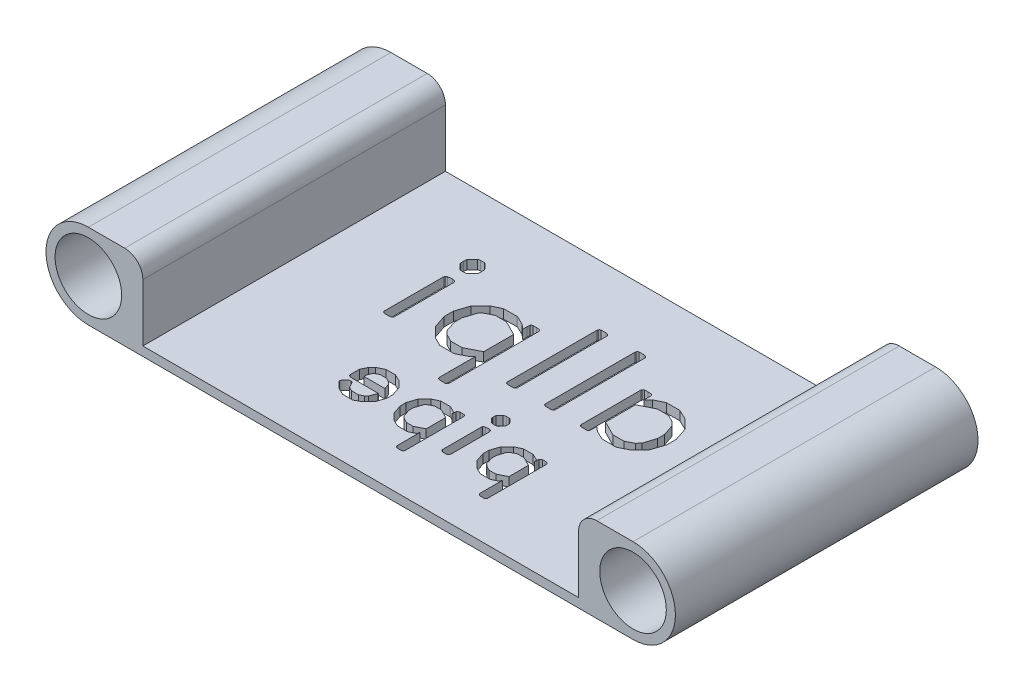
from build123d import *

# Parameters (mm, degrees)
SKETCH1_R           = 11
BOSS_EXTRUDE1_DEPTH = 100
CUT_EXTRUDE1_DEPTH  = 10
CUT_EXTRUDE2_DEPTH  = 10


with BuildPart() as part:
    # Sketch1 → Boss-Extrude1 (new body)
    with BuildSketch(Plane.XY):
        with BuildLine():
            Line((180, -14), (0, -14))
            ThreePointArc((0, -14), (-14, 0), (0, 14))
            Line((0, 14), (12, 14))
            ThreePointArc((12, 14), (16.242640687, 12.242640687), (18, 8))
            Line((18, 8), (18, -5))
            Line((18, -5), (18, -11))
            Line((18, -11), (24, -11))
            Line((24, -11), (25, -11))
            Line((25, -11), (155, -11))
            Line((155, -11), (156, -11))
            Line((156, -11), (162, -11))
            Line((162, -11), (162, -5))
            Line((162, -5), (162, 8))
            ThreePointArc((162, 8), (163.757359313, 12.242640687), (168, 14))
            Line((168, 14), (180, 14))
            ThreePointArc((180, 14), (194, 0), (180, -14))
        make_face()
        Circle(SKETCH1_R, mode=Mode.SUBTRACT)
        with Locations((180, 0)):
            Circle(SKETCH1_R, mode=Mode.SUBTRACT)
    extrude(amount=BOSS_EXTRUDE1_DEPTH)

    # Sketch3 → Cut-Extrude1 (cut)
    # profile 1 of 6: a face of its own
    with BuildSketch(Plane(origin=(0, -14, 0), x_dir=(-1, 0, 0), z_dir=(0, -1, 0))):
        with BuildLine():
            add(Edge.make_bspline(
                [(-120.723772714, -29.719538981), (-120.527466544, -29.811853521), (-120.090458077, -30.017360234), (-119.368965663, -30.358240333), (-118.515838935, -30.760979126), (-117.90451555, -31.052841221), (-117.577501363, -31.208966519)],
                knots=[0, 0, 0, 0, 0.747812145, 1.664747666, 2.750807408, 4, 4, 4, 4], degree=3))
            Line((-117.577501363, -31.208966519), (-116.232398198, -32.530977784))
            Line((-116.232398198, -32.530977784), (-116.232398198, -30.308382426))
            add(Edge.make_bspline(
                [(-116.232398198, -30.308382426), (-116.215250099, -30.237531157), (-116.182938448, -30.104028228), (-116.076216356, -29.938214819), (-115.934486963, -29.816322531), (-115.748659377, -29.759137796), (-115.533669716, -29.719344407), (-115.278049659, -29.701134513), (-114.983828981, -29.681179143), (-114.773816325, -29.679840131), (-114.66214901, -29.679128156)],
                knots=[0, 0, 0, 0, 0.93046279, 1.753243242, 2.490653353, 3.280471223, 4.211262276, 5.303341114, 6.566140431, 8, 8, 8, 8], degree=3))
            Line((-114.66214901, -29.679128156), (-113.536418894, -29.679128156))
            add(Edge.make_bspline(
                [(-113.536418894, -29.679128156), (-113.473726445, -29.695509466), (-113.354904069, -29.726557322), (-113.198163817, -29.817373675), (-113.071549006, -29.938419901), (-113.023492153, -30.042760682), (-112.999532223, -30.094782353)],
                knots=[0, 0, 0, 0, 1.092314502, 2.07028767, 3.037894303, 4, 4, 4, 4], degree=3))
            Line((-112.999532223, -30.094782353), (-112.907164624, -30.516209525))
            Line((-112.907164624, -30.516209525), (-112.907164624, -50.109686524))
            add(Edge.make_bspline(
                [(-112.907164624, -50.109686524), (-112.935369151, -50.17472428), (-112.988339176, -50.29686962), (-113.10247661, -50.447361565), (-113.221970999, -50.573638831), (-113.378293033, -50.640164403), (-113.554764664, -50.689224509), (-113.769056365, -50.711235281), (-114.022595276, -50.738851153), (-114.20596361, -50.738909518), (-114.304224563, -50.738940794)],
                knots=[0, 0, 0, 0, 1.017957162, 1.911792947, 2.716738227, 3.486456027, 4.321467898, 5.357801898, 6.584134479, 8, 8, 8, 8], degree=3))
            Line((-114.304224563, -50.738940794), (-115.441500629, -50.738940794))
            add(Edge.make_bspline(
                [(-115.441500629, -50.738940794), (-115.518529876, -50.711971213), (-115.660985963, -50.662094299), (-115.831075709, -50.538053563), (-115.956869742, -50.39349905), (-115.982795597, -50.277258725), (-115.995706225, -50.219373048)],
                knots=[0, 0, 0, 0, 1.213651149, 2.244498052, 3.125790306, 4, 4, 4, 4], degree=3))
            add(Edge.make_bspline(
                [(-115.995706225, -50.219373048), (-116.008511635, -50.104009167), (-116.039175862, -49.827755286), (-116.05484428, -49.343845448), (-116.075044229, -48.726270528), (-116.076002388, -48.270066849), (-116.076527875, -48.01986959)],
                knots=[0, 0, 0, 0, 0.632332228, 1.5142021, 2.63670582, 4, 4, 4, 4], degree=3))
            Line((-116.076527875, -48.01986959), (-117.554409463, -49.341880855))
            Line((-117.554409463, -49.341880855), (-120.515945615, -50.738940794))
            Line((-120.515945615, -50.738940794), (-125.249785079, -50.738940794))
            Line((-125.249785079, -50.738940794), (-128.251732056, -49.197556481))
            Line((-128.251732056, -49.197556481), (-131.380684482, -46.10901488))
            Line((-131.380684482, -46.10901488), (-132.858566071, -41.686916064))
            Line((-132.858566071, -41.686916064), (-132.858566071, -38.563736613))
            Line((-132.858566071, -38.563736613), (-131.432641257, -34.309054071))
            add(Edge.make_bspline(
                [(-131.432641257, -34.309054071), (-131.220075522, -34.080997755), (-130.768129863, -33.596116868), (-130.028543328, -32.847742266), (-129.189485657, -32.033595817), (-128.59318173, -31.473635162), (-128.280596931, -31.180101645)],
                knots=[0, 0, 0, 0, 0.84209508, 1.790416582, 2.84172792, 4, 4, 4, 4], degree=3))
            add(Edge.make_bspline(
                [(-128.280596931, -31.180101645), (-128.090228764, -31.085526782), (-127.662460357, -30.873011532), (-126.947456655, -30.526678683), (-126.08687115, -30.125554879), (-125.467174163, -29.83512332), (-125.13432558, -29.679128156)],
                knots=[0, 0, 0, 0, 0.731706252, 1.644186751, 2.734657232, 4, 4, 4, 4], degree=3))
            Line((-125.13432558, -29.679128156), (-120.723772714, -29.719538981))
        make_face()
        Polygon((-116.232398198, -35.417465262), (-121.041286336, -33.004361731), (-124.770628158, -33.004361731), (-127.09136409, -34.170502672), (-128.245959081, -35.290459813), (-129.533332496, -39.077531384), (-129.533332496, -41.404040291), (-128.292142881, -45.312344336), (-127.218369539, -46.478485277), (-124.741763283, -47.725447867), (-121.064378236, -47.725447867), (-116.232398198, -45.312344336), align=None, mode=Mode.SUBTRACT)
    # profile 2 of 6: a face of its own
    with BuildSketch(Plane(origin=(0, -14, 0), x_dir=(-1, 0, 0), z_dir=(0, -1, 0))):
        with BuildLine():
            add(Edge.make_bspline(
                [(-101.70759321, -19.703427433), (-101.650796729, -19.722289202), (-101.539647458, -19.759201206), (-101.386372979, -19.856614405), (-101.261009731, -19.995257808), (-101.201126696, -20.107995488), (-101.170706539, -20.165265429)],
                knots=[0, 0, 0, 0, 0.977880004, 1.913686345, 2.940167456, 4, 4, 4, 4], degree=3))
            Line((-101.170706539, -20.165265429), (-101.084111915, -20.586692601))
            Line((-101.084111915, -20.586692601), (-101.084111915, -50.103913549))
            add(Edge.make_bspline(
                [(-101.084111915, -50.103913549), (-101.095783589, -50.161234372), (-101.119507635, -50.277745663), (-101.230589247, -50.433121665), (-101.382193577, -50.579326852), (-101.511249212, -50.656868611), (-101.580587761, -50.69852997)],
                knots=[0, 0, 0, 0, 0.865095261, 1.758407532, 2.795645228, 4, 4, 4, 4], degree=3))
            add(Edge.make_bspline(
                [(-101.580587761, -50.69852997), (-101.647897586, -50.704949868), (-101.79960339, -50.719419314), (-102.053992755, -50.727118674), (-102.359785052, -50.742750402), (-102.581208128, -50.740274949), (-102.700544902, -50.738940794)],
                knots=[0, 0, 0, 0, 0.723506857, 1.630671128, 2.723041564, 4, 4, 4, 4], degree=3))
            Line((-102.700544902, -50.738940794), (-103.826275019, -50.738940794))
            add(Edge.make_bspline(
                [(-103.826275019, -50.738940794), (-103.941415368, -50.67962217), (-104.187321995, -50.552934671), (-104.332267511, -50.316328649), (-104.409345489, -50.190508174)],
                knots=[0, 0, 0, 0, 0.936455845, 2, 2, 2, 2], degree=3))
            Line((-104.409345489, -50.190508174), (-104.409345489, -49.474659279))
            Line((-104.409345489, -49.474659279), (-104.409345489, -20.378865503))
            add(Edge.make_bspline(
                [(-104.409345489, -20.378865503), (-104.366624569, -20.275928649), (-104.282688935, -20.073684172), (-104.025278488, -19.849719362), (-103.687647538, -19.718900721), (-103.43700317, -19.708871862), (-103.300934298, -19.703427433)],
                knots=[0, 0, 0, 0, 0.945973713, 1.858595364, 2.837482298, 4, 4, 4, 4], degree=3))
            add(Edge.make_bspline(
                [(-103.300934298, -19.703427433), (-103.212415348, -19.703427433), (-102.975723375, -19.703427433), (-102.739031402, -19.703427433), (-102.590858378, -19.703427433)],
                knots=[0, 0, 0, 0, 0.74796748, 2, 2, 2, 2], degree=3))
            add(Edge.make_bspline(
                [(-102.590858378, -19.703427433), (-102.436912379, -19.703427433), (-102.142490657, -19.703427433), (-101.848068934, -19.703427433), (-101.70759321, -19.703427433)],
                knots=[0, 0, 0, 0, 1.045751634, 2, 2, 2, 2], degree=3))
        make_face()
    # profile 3 of 6: a face of its own
    with BuildSketch(Plane(origin=(0, -14, 0), x_dir=(-1, 0, 0), z_dir=(0, -1, 0))):
        with BuildLine():
            add(Edge.make_bspline(
                [(-89.145599707, -19.703427433), (-89.088803226, -19.722289202), (-88.977653955, -19.759201206), (-88.824379475, -19.856614405), (-88.699016227, -19.995257808), (-88.639133193, -20.107995488), (-88.608713036, -20.165265429)],
                knots=[0, 0, 0, 0, 0.977880004, 1.913686345, 2.940167456, 4, 4, 4, 4], degree=3))
            Line((-88.608713036, -20.165265429), (-88.522118411, -20.586692601))
            Line((-88.522118411, -20.586692601), (-88.522118411, -50.103913549))
            add(Edge.make_bspline(
                [(-88.522118411, -50.103913549), (-88.533790086, -50.161234372), (-88.557514131, -50.277745663), (-88.668595743, -50.433121665), (-88.820200074, -50.579326852), (-88.949255708, -50.656868611), (-89.018594258, -50.69852997)],
                knots=[0, 0, 0, 0, 0.865095261, 1.758407532, 2.795645228, 4, 4, 4, 4], degree=3))
            add(Edge.make_bspline(
                [(-89.018594258, -50.69852997), (-89.085904083, -50.704949868), (-89.237609886, -50.719419314), (-89.491999252, -50.727118674), (-89.797791548, -50.742750402), (-90.019214625, -50.740274949), (-90.138551399, -50.738940794)],
                knots=[0, 0, 0, 0, 0.723506857, 1.630671128, 2.723041564, 4, 4, 4, 4], degree=3))
            Line((-90.138551399, -50.738940794), (-91.264281515, -50.738940794))
            add(Edge.make_bspline(
                [(-91.264281515, -50.738940794), (-91.379421865, -50.67962217), (-91.625328492, -50.552934671), (-91.770274008, -50.316328649), (-91.847351986, -50.190508174)],
                knots=[0, 0, 0, 0, 0.936455845, 2, 2, 2, 2], degree=3))
            Line((-91.847351986, -50.190508174), (-91.847351986, -49.474659279))
            Line((-91.847351986, -49.474659279), (-91.847351986, -20.378865503))
            add(Edge.make_bspline(
                [(-91.847351986, -20.378865503), (-91.804631066, -20.275928649), (-91.720695431, -20.073684172), (-91.463284984, -19.849719362), (-91.125654035, -19.718900721), (-90.875009667, -19.708871862), (-90.738940794, -19.703427433)],
                knots=[0, 0, 0, 0, 0.945973713, 1.858595364, 2.837482298, 4, 4, 4, 4], degree=3))
            add(Edge.make_bspline(
                [(-90.738940794, -19.703427433), (-90.650421845, -19.703427433), (-90.413729872, -19.703427433), (-90.177037899, -19.703427433), (-90.028864875, -19.703427433)],
                knots=[0, 0, 0, 0, 0.74796748, 2, 2, 2, 2], degree=3))
            add(Edge.make_bspline(
                [(-90.028864875, -19.703427433), (-89.874918876, -19.703427433), (-89.580497153, -19.703427433), (-89.28607543, -19.703427433), (-89.145599707, -19.703427433)],
                knots=[0, 0, 0, 0, 1.045751634, 2, 2, 2, 2], degree=3))
        make_face()
    # profile 4 of 6: a face of its own
    with BuildSketch(Plane(origin=(0, -14, 0), x_dir=(-1, 0, 0), z_dir=(0, -1, 0))):
        with BuildLine():
            add(Edge.make_bspline(
                [(-66.954283977, -29.719538981), (-66.898659611, -29.746868563), (-66.76726857, -29.811424127), (-66.533240253, -29.912478154), (-66.242145237, -30.052171347), (-65.887333033, -30.222085374), (-65.466562897, -30.413545761), (-64.988503233, -30.651073192), (-64.438930234, -30.898352065), (-64.055812355, -31.082954528), (-63.854196426, -31.180101645)],
                knots=[0, 0, 0, 0, 0.433973473, 1.025094407, 1.784689959, 2.69492059, 3.780168095, 5.021826328, 6.432734973, 8, 8, 8, 8], degree=3))
            Line((-63.854196426, -31.180101645), (-60.800292674, -34.268643246))
            Line((-60.800292674, -34.268643246), (-59.333957036, -38.731152887))
            Line((-59.333957036, -38.731152887), (-59.333957036, -41.733099864))
            Line((-59.333957036, -41.733099864), (-60.800292674, -46.149425705))
            add(Edge.make_bspline(
                [(-60.800292674, -46.149425705), (-60.965638411, -46.320831557), (-61.285925481, -46.652857524), (-61.753142452, -47.132420039), (-62.192283011, -47.574654167), (-62.59623924, -47.988519737), (-62.974894164, -48.360421603), (-63.325399274, -48.696809588), (-63.638559333, -49.003558404), (-63.844052675, -49.19041379), (-63.94079105, -49.278378131)],
                knots=[0, 0, 0, 0, 1.289125257, 2.497132124, 3.624054416, 4.662594583, 5.627483264, 6.49671914, 7.292313092, 8, 8, 8, 8], degree=3))
            Line((-63.94079105, -49.278378131), (-66.873462328, -50.738940794))
            Line((-66.873462328, -50.738940794), (-71.561117992, -50.738940794))
            Line((-71.561117992, -50.738940794), (-74.661205543, -49.220648381))
            Line((-74.661205543, -49.220648381), (-75.960124908, -48.01986959))
            Line((-75.960124908, -48.01986959), (-75.960124908, -60.079614273))
            add(Edge.make_bspline(
                [(-75.960124908, -60.079614273), (-75.978005232, -60.140719753), (-76.013074998, -60.260569643), (-76.123028827, -60.415844318), (-76.273419788, -60.540739108), (-76.393457646, -60.5979516), (-76.456600754, -60.628046893)],
                knots=[0, 0, 0, 0, 0.986308489, 1.93450672, 2.913495564, 4, 4, 4, 4], degree=3))
            add(Edge.make_bspline(
                [(-76.456600754, -60.628046893), (-76.566154792, -60.642847061), (-76.767594347, -60.670060473), (-77.043579734, -60.6887396), (-77.262605198, -60.709989782), (-77.389866551, -60.713257278), (-77.443779472, -60.714641518)],
                knots=[0, 0, 0, 0, 1.337634372, 2.45953938, 3.347400221, 4, 4, 4, 4], degree=3))
            add(Edge.make_bspline(
                [(-77.443779472, -60.714641518), (-77.534222746, -60.714641518), (-77.743974169, -60.714641518), (-77.953725593, -60.714641518), (-78.073033742, -60.714641518)],
                knots=[0, 0, 0, 0, 0.862385321, 2, 2, 2, 2], degree=3))
            add(Edge.make_bspline(
                [(-78.073033742, -60.714641518), (-78.200039191, -60.714641518), (-78.409790614, -60.714641518), (-78.619542037, -60.714641518), (-78.702288012, -60.714641518)],
                knots=[0, 0, 0, 0, 1.211009174, 2, 2, 2, 2], degree=3))
            add(Edge.make_bspline(
                [(-78.702288012, -60.714641518), (-78.825647834, -60.652392536), (-79.063522705, -60.532357761), (-79.213269204, -60.312473793), (-79.285358482, -60.206619722)],
                knots=[0, 0, 0, 0, 1.037182456, 2, 2, 2, 2], degree=3))
            Line((-79.285358482, -60.206619722), (-79.285358482, -59.490770827))
            Line((-79.285358482, -59.490770827), (-79.285358482, -30.314155401))
            add(Edge.make_bspline(
                [(-79.285358482, -30.314155401), (-79.230620138, -30.193467915), (-79.12134144, -29.952529476), (-78.907270253, -29.797108615), (-78.800428586, -29.719538981)],
                knots=[0, 0, 0, 0, 1.001811799, 2, 2, 2, 2], degree=3))
            add(Edge.make_bspline(
                [(-78.800428586, -29.719538981), (-78.740821589, -29.713112963), (-78.604564344, -29.698423555), (-78.373203261, -29.690904813), (-78.092445155, -29.675335151), (-77.888329886, -29.6778021), (-77.778612019, -29.679128156)],
                knots=[0, 0, 0, 0, 0.702902229, 1.606783182, 2.713576666, 4, 4, 4, 4], degree=3))
            Line((-77.778612019, -29.679128156), (-76.583606203, -29.679128156))
            add(Edge.make_bspline(
                [(-76.583606203, -29.679128156), (-76.469341976, -29.720177244), (-76.235927184, -29.804030823), (-76.08390899, -30.000343944), (-76.006308708, -30.100555328)],
                knots=[0, 0, 0, 0, 0.979065858, 2, 2, 2, 2], degree=3))
            add(Edge.make_bspline(
                [(-76.006308708, -30.100555328), (-75.992911928, -30.237085017), (-75.961461611, -30.557602486), (-75.96061239, -30.879730092), (-75.960124908, -31.064642146)],
                knots=[0, 0, 0, 0, 0.851932903, 2, 2, 2, 2], degree=3))
            Line((-75.960124908, -31.064642146), (-75.960124908, -32.49056696))
            Line((-75.960124908, -32.49056696), (-74.493789269, -31.12814487))
            Line((-74.493789269, -31.12814487), (-71.561117992, -29.719538981))
            Line((-71.561117992, -29.719538981), (-71.353290893, -29.679128156))
            Line((-71.353290893, -29.679128156), (-66.954283977, -29.719538981))
        make_face()
        Polygon((-64.974153567, -34.251324321), (-67.450759823, -33.004361731), (-71.168555695, -33.004361731), (-75.960124908, -35.417465262), (-75.960124908, -45.312344336), (-71.15123677, -47.725447867), (-67.468078748, -47.725447867), (-65.101159016, -46.518896102), (-63.859969401, -45.39893896), (-62.65919061, -41.652278214), (-62.65919061, -39.244947658), (-63.900380226, -35.330870638), align=None, mode=Mode.SUBTRACT)
    # profile 5 of 6: a face of its own
    with BuildSketch(Plane(origin=(0, -14, 0), x_dir=(-1, 0, 0), z_dir=(0, -1, 0))):
        with BuildLine():
            Line((-48.474991144, -19.917027506), (-46.835466257, -21.648919993))
            add(Edge.make_bspline(
                [(-46.835466257, -21.648919993), (-46.796988447, -21.825276564), (-46.719385474, -22.180956743), (-46.712122559, -22.54495099), (-46.708460808, -22.72846631)],
                knots=[0, 0, 0, 0, 0.991658129, 2, 2, 2, 2], degree=3))
            add(Edge.make_bspline(
                [(-46.708460808, -22.72846631), (-46.711724977, -22.799709683), (-46.719678762, -22.973308073), (-46.738043584, -23.146134308), (-46.748871632, -23.248034056)],
                knots=[0, 0, 0, 0, 0.820783807, 2, 2, 2, 2], degree=3))
            add(Edge.make_bspline(
                [(-46.748871632, -23.248034056), (-46.73518819, -23.344383593), (-46.712707299, -23.502678806), (-46.738699933, -23.659894698), (-46.748871632, -23.721418002)],
                knots=[0, 0, 0, 0, 1.217339885, 2, 2, 2, 2], degree=3))
            Line((-46.748871632, -23.721418002), (-46.875877081, -24.027385675))
            Line((-46.875877081, -24.027385675), (-48.515401969, -25.713094362))
            Line((-48.515401969, -25.713094362), (-48.856007491, -25.840099811))
            Line((-48.856007491, -25.840099811), (-50.033694382, -25.840099811))
            add(Edge.make_bspline(
                [(-50.033694382, -25.840099811), (-50.215580412, -25.835318872), (-50.551487246, -25.826489442), (-50.857477717, -25.68937142), (-50.9977812, -25.626499737)],
                knots=[0, 0, 0, 0, 1.082955219, 2, 2, 2, 2], degree=3))
            Line((-50.9977812, -25.626499737), (-52.596895262, -23.894607251))
            Line((-52.596895262, -23.894607251), (-52.683489887, -23.594412553))
            Line((-52.683489887, -23.594412553), (-52.683489887, -22.428271612))
            add(Edge.make_bspline(
                [(-52.683489887, -22.428271612), (-52.680707422, -22.254911611), (-52.675667739, -21.940916912), (-52.565442334, -21.647541238), (-52.516073613, -21.516141569)],
                knots=[0, 0, 0, 0, 1.104222468, 2, 2, 2, 2], degree=3))
            Line((-52.516073613, -21.516141569), (-50.830364926, -19.790022057))
            Line((-50.830364926, -19.790022057), (-50.582127003, -19.703427433))
            add(Edge.make_bspline(
                [(-50.582127003, -19.703427433), (-50.514775628, -19.703427433), (-50.358905305, -19.703427433), (-50.203034981, -19.703427433), (-50.114516032, -19.703427433)],
                knots=[0, 0, 0, 0, 0.864197531, 2, 2, 2, 2], degree=3))
            add(Edge.make_bspline(
                [(-50.114516032, -19.703427433), (-50.058710607, -19.703427433), (-49.918234883, -19.703427433), (-49.777759159, -19.703427433), (-49.69308886, -19.703427433)],
                knots=[0, 0, 0, 0, 0.794520548, 2, 2, 2, 2], degree=3))
            add(Edge.make_bspline(
                [(-49.69308886, -19.703427433), (-49.61611586, -19.703427433), (-49.477564461, -19.703427433), (-49.339013063, -19.703427433), (-49.277434663, -19.703427433)],
                knots=[0, 0, 0, 0, 1.111111111, 2, 2, 2, 2], degree=3))
            add(Edge.make_bspline(
                [(-49.277434663, -19.703427433), (-49.13021337, -19.710110398), (-48.846843016, -19.722973715), (-48.595670382, -19.854050107), (-48.474991144, -19.917027506)],
                knots=[0, 0, 0, 0, 1.039073355, 2, 2, 2, 2], degree=3))
        make_face()
    # profile 6 of 6: a face of its own
    with BuildSketch(Plane(origin=(0, -14, 0), x_dir=(-1, 0, 0), z_dir=(0, -1, 0))):
        with BuildLine():
            add(Edge.make_bspline(
                [(-48.521174944, -29.806133605), (-48.457029539, -29.816868641), (-48.334183761, -29.83742746), (-48.168973877, -29.909711542), (-48.04263768, -30.029585806), (-47.992891767, -30.129376435), (-47.966969348, -30.181376977)],
                knots=[0, 0, 0, 0, 1.104160075, 2.114592696, 3.017520937, 4, 4, 4, 4], degree=3))
            Line((-47.966969348, -30.181376977), (-47.880374724, -30.597031174))
            Line((-47.880374724, -30.597031174), (-47.880374724, -50.115459499))
            add(Edge.make_bspline(
                [(-47.880374724, -50.115459499), (-47.89233895, -50.17076392), (-47.917066106, -50.28506475), (-48.026915545, -50.438697201), (-48.177088093, -50.585355976), (-48.307307603, -50.659130902), (-48.37685057, -50.69852997)],
                knots=[0, 0, 0, 0, 0.846559354, 1.749632947, 2.798204654, 4, 4, 4, 4], degree=3))
            add(Edge.make_bspline(
                [(-48.37685057, -50.69852997), (-48.444160395, -50.704949868), (-48.595866199, -50.719419314), (-48.850255564, -50.727118674), (-49.156047861, -50.742750402), (-49.377470937, -50.740274949), (-49.496807711, -50.738940794)],
                knots=[0, 0, 0, 0, 0.723506857, 1.630671128, 2.723041564, 4, 4, 4, 4], degree=3))
            Line((-49.496807711, -50.738940794), (-50.622537828, -50.738940794))
            add(Edge.make_bspline(
                [(-50.622537828, -50.738940794), (-50.737527179, -50.679521911), (-50.98172253, -50.553337922), (-51.128138346, -50.319831525), (-51.205608298, -50.196281148)],
                knots=[0, 0, 0, 0, 0.941781654, 2, 2, 2, 2], degree=3))
            Line((-51.205608298, -50.196281148), (-51.205608298, -49.491978204))
            Line((-51.205608298, -49.491978204), (-51.205608298, -30.389204076))
            add(Edge.make_bspline(
                [(-51.205608298, -30.389204076), (-51.163692325, -30.280147278), (-51.082679986, -30.069369722), (-50.822206502, -29.83741425), (-50.484921413, -29.699934628), (-50.233425173, -29.686438571), (-50.097197107, -29.679128156)],
                knots=[0, 0, 0, 0, 0.974897308, 1.884215162, 2.853942009, 4, 4, 4, 4], degree=3))
            add(Edge.make_bspline(
                [(-50.097197107, -29.679128156), (-50.066379489, -29.678502425), (-49.991094373, -29.676973813), (-49.854979902, -29.694583727), (-49.671750963, -29.701522688), (-49.369783857, -29.727184446), (-48.980525608, -29.755760741), (-48.669271223, -29.789893216), (-48.521174944, -29.806133605)],
                knots=[0, 0, 0, 0, 0.35041127, 0.856028293, 1.558218293, 2.436706842, 4.304568602, 6, 6, 6, 6], degree=3))
        make_face()
    extrude(amount=-CUT_EXTRUDE1_DEPTH, mode=Mode.SUBTRACT)


with BuildPart() as cut_extrude1_piece_1:
    # of the separate pieces the step leaves, piece 1, a body of its own (cut_extrude1_pieces)
    add(part.part.solids().sort_by_distance((180, 14, 0))[0])

    # Sketch4 → Cut-Extrude2 (cut)
    # profile 1 of 5: a face of its own
    with BuildSketch(Plane.XZ.offset(14)):
        with BuildLine():
            add(Edge.make_bspline(
                [(110.320871844, 66.540239162), (110.279839943, 66.559525954), (110.183748178, 66.604693297), (110.016443281, 66.681817651), (109.806698891, 66.78198081), (109.550811233, 66.901310783), (109.25069499, 67.043883674), (108.905213619, 67.209980631), (108.513339481, 67.393465653), (108.237459533, 67.522907681), (108.092503511, 67.590920604)],
                knots=[0, 0, 0, 0, 0.441671429, 1.034341253, 1.794628368, 2.705907484, 3.784813583, 5.03135813, 6.440181965, 8, 8, 8, 8], degree=3))
            Line((108.092503511, 67.590920604), (106.002686577, 69.715375387))
            Line((106.002686577, 69.715375387), (105.025129485, 72.701927764))
            Line((105.025129485, 72.701927764), (105.025129485, 74.633950049))
            Line((105.025129485, 74.633950049), (106.002686577, 77.589713227))
            add(Edge.make_bspline(
                [(106.002686577, 77.589713227), (106.213916466, 77.809516673), (106.612461504, 78.224238159), (107.181793512, 78.803195058), (107.688428413, 79.298643229), (108.007434364, 79.599127027), (108.15408191, 79.73725991)],
                knots=[0, 0, 0, 0, 1.203243914, 2.270260594, 3.204836022, 4, 4, 4, 4], degree=3))
            Line((108.15408191, 79.73725991), (110.263142094, 80.791790002))
            Line((110.263142094, 80.791790002), (113.553737819, 80.791790002))
            Line((113.553737819, 80.791790002), (115.643554753, 79.76420046))
            Line((115.643554753, 79.76420046), (115.862927801, 79.006016416))
            Line((115.862927801, 79.006016416), (115.870625101, 86.568613608))
            add(Edge.make_bspline(
                [(115.870625101, 86.568613608), (115.889502208, 86.621554202), (115.929679185, 86.734230005), (116.058335129, 86.879878578), (116.231885557, 87.018235884), (116.374282708, 87.088456022), (116.451771247, 87.126667853)],
                knots=[0, 0, 0, 0, 0.805439606, 1.714252632, 2.75616034, 4, 4, 4, 4], degree=3))
            add(Edge.make_bspline(
                [(116.451771247, 87.126667853), (116.541562187, 87.137016993), (116.705664639, 87.155931141), (116.926118808, 87.180165509), (117.096924703, 87.192407109), (117.193267516, 87.194910082), (117.233047191, 87.195943553)],
                knots=[0, 0, 0, 0, 1.382273199, 2.526250637, 3.391493058, 4, 4, 4, 4], degree=3))
            add(Edge.make_bspline(
                [(117.233047191, 87.195943553), (117.28692829, 87.195943553), (117.411367973, 87.195943553), (117.535807655, 87.195943553), (117.606366238, 87.195943553)],
                knots=[0, 0, 0, 0, 0.865979381, 2, 2, 2, 2], degree=3))
            add(Edge.make_bspline(
                [(117.606366238, 87.195943553), (117.687187887, 87.195943553), (117.830870819, 87.195943553), (117.974553752, 87.195943553), (118.037415035, 87.195943553)],
                knots=[0, 0, 0, 0, 1.125, 2, 2, 2, 2], degree=3))
            add(Edge.make_bspline(
                [(118.037415035, 87.195943553), (118.095187448, 87.165894421), (118.208945066, 87.106725736), (118.354818608, 86.984052664), (118.483178101, 86.845645108), (118.542499409, 86.735633352), (118.57237738, 86.680224457)],
                knots=[0, 0, 0, 0, 1.029154353, 2.026471455, 3.006005913, 4, 4, 4, 4], degree=3))
            Line((118.57237738, 86.680224457), (118.57237738, 86.152959411))
            Line((118.57237738, 86.152959411), (118.57237738, 67.113688007))
            add(Edge.make_bspline(
                [(118.57237738, 67.113688007), (118.551425632, 67.05622776), (118.510057401, 66.942775234), (118.409631259, 66.78910584), (118.282719752, 66.653976375), (118.181144284, 66.580992246), (118.129782634, 66.544087812)],
                knots=[0, 0, 0, 0, 0.994694416, 1.963976798, 2.970484582, 4, 4, 4, 4], degree=3))
            add(Edge.make_bspline(
                [(118.129782634, 66.544087812), (118.02851206, 66.533798079), (117.796941046, 66.510268994), (117.564158906, 66.507282022), (117.433176989, 66.505601312)],
                knots=[0, 0, 0, 0, 0.874639465, 2, 2, 2, 2], degree=3))
            Line((117.433176989, 66.505601312), (116.667295645, 66.509449962))
            add(Edge.make_bspline(
                [(116.667295645, 66.509449962), (116.582854076, 66.533581529), (116.42045432, 66.579991852), (116.202921256, 66.691975089), (116.020392374, 66.836384009), (115.935831217, 66.95983686), (115.893717001, 67.021320408)],
                knots=[0, 0, 0, 0, 1.104277491, 2.123769082, 3.065575772, 4, 4, 4, 4], degree=3))
            add(Edge.make_bspline(
                [(115.893717001, 67.021320408), (115.886542153, 67.111083216), (115.869547728, 67.323696404), (115.86535209, 67.536966408), (115.862927801, 67.660196303)],
                knots=[0, 0, 0, 0, 0.844376676, 2, 2, 2, 2], degree=3))
            Line((115.862927801, 67.660196303), (115.862927801, 68.349104648))
            Line((115.862927801, 68.349104648), (115.543489854, 67.498553004))
            Line((115.543489854, 67.498553004), (113.569132419, 66.551785112))
            Line((113.569132419, 66.551785112), (113.39209452, 66.509449962))
            Line((113.39209452, 66.509449962), (110.320871844, 66.540239162))
        make_face()
        Polygon((109.181671453, 69.761559187), (110.751920641, 68.968737293), (112.991834923, 68.968737293), (115.862927801, 70.419678332), (115.862927801, 76.873864332), (112.987986273, 78.320956721), (110.748071991, 78.320956721), (109.262493102, 77.558924027), (108.504309058, 76.870015682), (107.734579064, 74.472306751), (107.734579064, 72.948241362), (108.538946908, 70.411981032), align=None, mode=Mode.SUBTRACT)
    # profile 2 of 5: a face of its own
    with BuildSketch(Plane.XZ.offset(14)):
        with BuildLine():
            Line((97.454834993, 60.359307309), (96.277148102, 61.55623745))
            add(Edge.make_bspline(
                [(96.277148102, 61.55623745), (96.251811811, 61.673824603), (96.201237837, 61.908541266), (96.19282658, 62.148494837), (96.188629152, 62.268237694)],
                knots=[0, 0, 0, 0, 1.001949772, 2, 2, 2, 2], degree=3))
            add(Edge.make_bspline(
                [(96.188629152, 62.268237694), (96.192070824, 62.318309262), (96.20011823, 62.43538792), (96.214840864, 62.551824964), (96.223267002, 62.618464842)],
                knots=[0, 0, 0, 0, 0.855349196, 2, 2, 2, 2], degree=3))
            add(Edge.make_bspline(
                [(96.223267002, 62.618464842), (96.244603966, 62.638394246), (96.28070665, 62.672115302), (96.320093296, 62.739517554), (96.277140581, 62.798651854), (96.238491747, 62.81841774), (96.215569702, 62.83014059)],
                knots=[0, 0, 0, 0, 1.268045533, 2.145565185, 2.900162494, 4, 4, 4, 4], degree=3))
            Line((96.215569702, 62.83014059), (96.315634601, 63.145729888))
            Line((96.315634601, 63.145729888), (97.508716092, 64.327265429))
            Line((97.508716092, 64.327265429), (97.951310839, 64.488908727))
            Line((97.951310839, 64.488908727), (98.855743582, 64.488908727))
            add(Edge.make_bspline(
                [(98.855743582, 64.488908727), (99.000478938, 64.483075887), (99.277380324, 64.471916751), (99.528638867, 64.355764681), (99.648565476, 64.300324879)],
                knots=[0, 0, 0, 0, 1.045392784, 2, 2, 2, 2], degree=3))
            Line((99.648565476, 64.300324879), (100.756976667, 63.138032588))
            Line((100.756976667, 63.138032588), (100.837798317, 62.85708114))
            Line((100.837798317, 62.85708114), (100.837798317, 62.075805196))
            add(Edge.make_bspline(
                [(100.837798317, 62.075805196), (100.832864449, 61.943241421), (100.823607043, 61.694512293), (100.730967112, 61.463839877), (100.687700968, 61.356107651)],
                knots=[0, 0, 0, 0, 1.065928838, 2, 2, 2, 2], degree=3))
            Line((100.687700968, 61.356107651), (99.517711377, 60.18996671))
            Line((99.517711377, 60.18996671), (99.252154529, 60.109145061))
            add(Edge.make_bspline(
                [(99.252154529, 60.109145061), (99.199557183, 60.107824043), (99.086669604, 60.104988796), (98.973769992, 60.102680539), (98.913473331, 60.101447761)],
                knots=[0, 0, 0, 0, 0.931853546, 2, 2, 2, 2], degree=3))
            add(Edge.make_bspline(
                [(98.913473331, 60.101447761), (98.876269715, 60.101447761), (98.783902116, 60.101447761), (98.691534517, 60.101447761), (98.636370534, 60.101447761)],
                knots=[0, 0, 0, 0, 0.805555556, 2, 2, 2, 2], degree=3))
            add(Edge.make_bspline(
                [(98.636370534, 60.101447761), (98.586338084, 60.101447761), (98.493970485, 60.101447761), (98.401602885, 60.101447761), (98.359267736, 60.101447761)],
                knots=[0, 0, 0, 0, 1.083333333, 2, 2, 2, 2], degree=3))
            add(Edge.make_bspline(
                [(98.359267736, 60.101447761), (98.278160219, 60.104034032), (98.116917793, 60.109175561), (97.882657667, 60.161591111), (97.658994877, 60.241660394), (97.523092076, 60.319974238), (97.454834993, 60.359307309)],
                knots=[0, 0, 0, 0, 1.02008174, 2.027931069, 3.009529812, 4, 4, 4, 4], degree=3))
        make_face()
    # profile 3 of 5: a face of its own
    with BuildSketch(Plane.XZ.offset(14)):
        with BuildLine():
            add(Edge.make_bspline(
                [(97.78581889, 66.609514861), (97.718318214, 66.621811177), (97.591423559, 66.644927046), (97.420282338, 66.725744576), (97.295047526, 66.856798116), (97.245419663, 66.963144745), (97.220067345, 67.017471758)],
                knots=[0, 0, 0, 0, 1.115249933, 2.096560578, 3.027630868, 4, 4, 4, 4], degree=3))
            Line((97.220067345, 67.017471758), (97.143094345, 67.390790805))
            Line((97.143094345, 67.390790805), (97.146942995, 80.152914107))
            add(Edge.make_bspline(
                [(97.146942995, 80.152914107), (97.160998692, 80.200383978), (97.192388083, 80.306394405), (97.310962764, 80.452091799), (97.478854318, 80.602535123), (97.617459424, 80.692456893), (97.693451291, 80.741757552)],
                knots=[0, 0, 0, 0, 0.715478755, 1.597817852, 2.682975613, 4, 4, 4, 4], degree=3))
            add(Edge.make_bspline(
                [(97.693451291, 80.741757552), (97.838290875, 80.756817131), (98.137667887, 80.787944612), (98.4386628, 80.79048082), (98.594035384, 80.791790002)],
                knots=[0, 0, 0, 0, 0.967606583, 2, 2, 2, 2], degree=3))
            Line((98.594035384, 80.791790002), (99.309884278, 80.791790002))
            add(Edge.make_bspline(
                [(99.309884278, 80.791790002), (99.365268544, 80.767330592), (99.478494321, 80.717326575), (99.623099179, 80.593046516), (99.755446165, 80.440445075), (99.819122371, 80.317505802), (99.852543924, 80.252979006)],
                knots=[0, 0, 0, 0, 0.922895483, 1.886737299, 2.890817671, 4, 4, 4, 4], degree=3))
            Line((99.852543924, 80.252979006), (99.852543924, 79.72956261))
            Line((99.852543924, 79.72956261), (99.852543924, 67.175266407))
            add(Edge.make_bspline(
                [(99.852543924, 67.175266407), (99.817079009, 67.074032063), (99.750113554, 66.88287966), (99.541808439, 66.658630712), (99.264252625, 66.525269455), (99.057419596, 66.512401729), (98.948111181, 66.505601312)],
                knots=[0, 0, 0, 0, 1.046316737, 1.975672999, 2.930170979, 4, 4, 4, 4], degree=3))
            add(Edge.make_bspline(
                [(98.948111181, 66.505601312), (98.898083562, 66.509513041), (98.760850441, 66.520243489), (98.5091292, 66.537300415), (98.1717129, 66.568502037), (97.921768628, 66.59506612), (97.78581889, 66.609514861)],
                knots=[0, 0, 0, 0, 0.51598617, 1.415426007, 2.594197993, 4, 4, 4, 4], degree=3))
        make_face()
    # profile 4 of 5: a face of its own
    with BuildSketch(Plane.XZ.offset(14)):
        with BuildLine():
            add(Edge.make_bspline(
                [(82.980062454, 66.540239162), (82.939030553, 66.559525954), (82.842938788, 66.604693297), (82.675633891, 66.681817651), (82.465889501, 66.78198081), (82.210001843, 66.901310783), (81.909885601, 67.043883674), (81.56440423, 67.209980631), (81.172530091, 67.393465653), (80.896650143, 67.522907681), (80.751694121, 67.590920604)],
                knots=[0, 0, 0, 0, 0.441671429, 1.034341253, 1.794628368, 2.705907484, 3.784813583, 5.03135813, 6.440181965, 8, 8, 8, 8], degree=3))
            Line((80.751694121, 67.590920604), (78.661877187, 69.715375387))
            Line((78.661877187, 69.715375387), (77.684320095, 72.701927764))
            Line((77.684320095, 72.701927764), (77.684320095, 74.633950049))
            Line((77.684320095, 74.633950049), (78.661877187, 77.589713227))
            add(Edge.make_bspline(
                [(78.661877187, 77.589713227), (78.873107076, 77.809516673), (79.271652115, 78.224238159), (79.840984122, 78.803195058), (80.347619023, 79.298643229), (80.666624974, 79.599127027), (80.813272521, 79.73725991)],
                knots=[0, 0, 0, 0, 1.203243914, 2.270260594, 3.204836022, 4, 4, 4, 4], degree=3))
            Line((80.813272521, 79.73725991), (82.922332704, 80.791790002))
            Line((82.922332704, 80.791790002), (86.212928429, 80.791790002))
            Line((86.212928429, 80.791790002), (88.302745363, 79.76420046))
            Line((88.302745363, 79.76420046), (88.522118411, 79.006016416))
            Line((88.522118411, 79.006016416), (88.529815711, 86.568613608))
            add(Edge.make_bspline(
                [(88.529815711, 86.568613608), (88.548692818, 86.621554202), (88.588869796, 86.734230005), (88.71752574, 86.879878578), (88.891076167, 87.018235884), (89.033473318, 87.088456022), (89.110961857, 87.126667853)],
                knots=[0, 0, 0, 0, 0.805439606, 1.714252632, 2.75616034, 4, 4, 4, 4], degree=3))
            add(Edge.make_bspline(
                [(89.110961857, 87.126667853), (89.200752797, 87.137016993), (89.364855249, 87.155931141), (89.585309418, 87.180165509), (89.756115313, 87.192407109), (89.852458126, 87.194910082), (89.892237801, 87.195943553)],
                knots=[0, 0, 0, 0, 1.382273199, 2.526250637, 3.391493058, 4, 4, 4, 4], degree=3))
            add(Edge.make_bspline(
                [(89.892237801, 87.195943553), (89.9461189, 87.195943553), (90.070558583, 87.195943553), (90.194998265, 87.195943553), (90.265556848, 87.195943553)],
                knots=[0, 0, 0, 0, 0.865979381, 2, 2, 2, 2], degree=3))
            add(Edge.make_bspline(
                [(90.265556848, 87.195943553), (90.346378497, 87.195943553), (90.49006143, 87.195943553), (90.633744362, 87.195943553), (90.696605645, 87.195943553)],
                knots=[0, 0, 0, 0, 1.125, 2, 2, 2, 2], degree=3))
            add(Edge.make_bspline(
                [(90.696605645, 87.195943553), (90.754378058, 87.165894421), (90.868135676, 87.106725736), (91.014009218, 86.984052664), (91.142368711, 86.845645108), (91.201690019, 86.735633352), (91.231567991, 86.680224457)],
                knots=[0, 0, 0, 0, 1.029154353, 2.026471455, 3.006005913, 4, 4, 4, 4], degree=3))
            Line((91.231567991, 86.680224457), (91.231567991, 86.152959411))
            Line((91.231567991, 86.152959411), (91.231567991, 67.113688007))
            add(Edge.make_bspline(
                [(91.231567991, 67.113688007), (91.210616242, 67.05622776), (91.169248011, 66.942775234), (91.068821869, 66.78910584), (90.941910362, 66.653976375), (90.840334894, 66.580992246), (90.788973244, 66.544087812)],
                knots=[0, 0, 0, 0, 0.994694416, 1.963976798, 2.970484582, 4, 4, 4, 4], degree=3))
            add(Edge.make_bspline(
                [(90.788973244, 66.544087812), (90.68770267, 66.533798079), (90.456131656, 66.510268994), (90.223349516, 66.507282022), (90.092367599, 66.505601312)],
                knots=[0, 0, 0, 0, 0.874639465, 2, 2, 2, 2], degree=3))
            Line((90.092367599, 66.505601312), (89.326486255, 66.509449962))
            add(Edge.make_bspline(
                [(89.326486255, 66.509449962), (89.242044686, 66.533581529), (89.079644931, 66.579991852), (88.862111866, 66.691975089), (88.679582984, 66.836384009), (88.595021827, 66.95983686), (88.552907611, 67.021320408)],
                knots=[0, 0, 0, 0, 1.104277491, 2.123769082, 3.065575772, 4, 4, 4, 4], degree=3))
            add(Edge.make_bspline(
                [(88.552907611, 67.021320408), (88.545732763, 67.111083216), (88.528738338, 67.323696404), (88.5245427, 67.536966408), (88.522118411, 67.660196303)],
                knots=[0, 0, 0, 0, 0.844376676, 2, 2, 2, 2], degree=3))
            Line((88.522118411, 67.660196303), (88.522118411, 68.349104648))
            Line((88.522118411, 68.349104648), (88.202680464, 67.498553004))
            Line((88.202680464, 67.498553004), (86.228323029, 66.551785112))
            Line((86.228323029, 66.551785112), (86.05128513, 66.509449962))
            Line((86.05128513, 66.509449962), (82.980062454, 66.540239162))
        make_face()
        Polygon((81.840862063, 69.761559187), (83.411111251, 68.968737293), (85.651025533, 68.968737293), (88.522118411, 70.419678332), (88.522118411, 76.873864332), (85.647176883, 78.320956721), (83.407262601, 78.320956721), (81.921683712, 77.558924027), (81.163499668, 76.870015682), (80.393769674, 74.472306751), (80.393769674, 72.948241362), (81.198137518, 70.411981032), align=None, mode=Mode.SUBTRACT)
    # profile 5 of 5: a face of its own
    with BuildSketch(Plane.XZ.offset(14)):
        with BuildLine():
            add(Edge.make_bspline(
                [(64.876012993, 66.536390512), (64.82057143, 66.558860115), (64.698092922, 66.608498751), (64.502499692, 66.705539563), (64.266126576, 66.809659898), (63.998338992, 66.942724078), (63.693990714, 67.092170851), (63.355461972, 67.261841827), (62.982111452, 67.450364567), (62.722000035, 67.583120818), (62.586066261, 67.652499003)],
                knots=[0, 0, 0, 0, 0.563290268, 1.244390444, 2.055444466, 2.995807001, 4.060413723, 5.249299314, 6.562488609, 8, 8, 8, 8], degree=3))
            Line((62.586066261, 67.652499003), (61.43531992, 68.849429144))
            Line((61.43531992, 68.849429144), (60.442368227, 70.877667678))
            Line((60.442368227, 70.877667678), (60.446216877, 73.964284955))
            add(Edge.make_bspline(
                [(60.446216877, 73.964284955), (60.464824508, 74.030669601), (60.502845945, 74.166315004), (60.653103332, 74.337937725), (60.860770556, 74.480661107), (61.029298976, 74.54285), (61.119730622, 74.5762203)],
                knots=[0, 0, 0, 0, 0.856879861, 1.750883983, 2.793133752, 4, 4, 4, 4], degree=3))
            Line((61.119730622, 74.5762203), (61.454563169, 74.633950049))
            Line((61.454563169, 74.633950049), (70.4450095, 74.633950049))
            Line((70.4450095, 74.633950049), (70.4450095, 74.664739249))
            Line((70.4450095, 74.664739249), (69.609852457, 77.023961681))
            Line((69.609852457, 77.023961681), (68.917095462, 77.670534876))
            Line((68.917095462, 77.670534876), (67.539278773, 78.320956721))
            Line((67.539278773, 78.320956721), (65.31860774, 78.320956721))
            Line((65.31860774, 78.320956721), (63.906153201, 77.612805127))
            Line((63.906153201, 77.612805127), (63.074844807, 75.930945089))
            add(Edge.make_bspline(
                [(63.074844807, 75.930945089), (63.030667867, 75.880147707), (62.944589501, 75.781169469), (62.782625084, 75.668688556), (62.594228244, 75.606170092), (62.462076807, 75.597008702), (62.393633762, 75.592263892)],
                knots=[0, 0, 0, 0, 1.021460292, 1.990306109, 2.959151927, 4, 4, 4, 4], degree=3))
            add(Edge.make_bspline(
                [(62.393633762, 75.592263892), (62.312370424, 75.595419018), (62.153742019, 75.601577915), (61.928896938, 75.665141319), (61.724613468, 75.766818929), (61.487067316, 75.969613335), (61.204020463, 76.273281417), (60.895441376, 76.567990673), (60.657836841, 76.822469667), (60.542547404, 77.034820426), (60.453345602, 77.242804218), (60.445998444, 77.387409793), (60.442368227, 77.458859128)],
                knots=[0, 0, 0, 0, 0.845901935, 1.651225252, 2.417446531, 3.207610786, 4.892304644, 6.747360803, 7.667811742, 8.501231686, 9.259461481, 10, 10, 10, 10], degree=3))
            Line((60.442368227, 77.458859128), (60.584768276, 77.735961926))
            Line((60.584768276, 77.735961926), (62.65919061, 79.74495721))
            Line((62.65919061, 79.74495721), (64.791342694, 80.791790002))
            Line((64.791342694, 80.791790002), (68.105030318, 80.791790002))
            Line((68.105030318, 80.791790002), (70.156360753, 79.73341126))
            Line((70.156360753, 79.73341126), (72.253874986, 77.651291626))
            Line((72.253874986, 77.651291626), (73.250675329, 74.664739249))
            Line((73.250675329, 74.664739249), (73.250675329, 72.528738516))
            Line((73.250675329, 72.528738516), (72.280815536, 69.653796988))
            add(Edge.make_bspline(
                [(72.280815536, 69.653796988), (72.137831307, 69.500466638), (71.832744175, 69.173303868), (71.330510584, 68.665611957), (70.758225387, 68.108755234), (70.348247784, 67.726129863), (70.133268853, 67.525493554)],
                knots=[0, 0, 0, 0, 0.831843938, 1.774915201, 2.833237848, 4, 4, 4, 4], degree=3))
            add(Edge.make_bspline(
                [(70.133268853, 67.525493554), (70.00237364, 67.462719152), (69.708505966, 67.32178682), (69.221611132, 67.085606736), (68.635211554, 66.815474664), (68.215149935, 66.616371316), (67.989570819, 66.509449962)],
                knots=[0, 0, 0, 0, 0.734319182, 1.648591009, 2.737259638, 4, 4, 4, 4], degree=3))
            Line((67.989570819, 66.509449962), (64.876012993, 66.536390512))
        make_face()
        Polygon((63.91769915, 69.746164587), (65.33400234, 68.968737293), (67.562370672, 68.968737293), (68.894003562, 69.699980787), (69.571365957, 70.423526982), (70.198695902, 72.170814068), (63.251882706, 72.170814068), (63.251882706, 71.316413775), align=None, mode=Mode.SUBTRACT)
    extrude(amount=-CUT_EXTRUDE2_DEPTH, mode=Mode.SUBTRACT)


with BuildPart() as cut_extrude1_piece_2:
    # of the separate pieces the step leaves, piece 2, a body of its own (cut_extrude1_pieces)
    add(part.part.solids().sort_by_distance((62.65919061, -14, 39.244947658))[0])


with BuildPart() as cut_extrude1_piece_3:
    # of the separate pieces the step leaves, piece 3, a body of its own (cut_extrude1_pieces)
    add(part.part.solids().sort_by_distance((116.232398198, -14, 45.312344336))[0])


with BuildPart() as cut_extrude2_piece_1:
    # of the separate pieces the step leaves, piece 1, a body of its own (cut_extrude2_pieces)
    add(cut_extrude1_piece_1.part.solids().sort_by_distance((180, 14, 0))[0])


with BuildPart() as cut_extrude2_piece_2:
    # of the separate pieces the step leaves, piece 2, a body of its own (cut_extrude2_pieces)
    add(cut_extrude1_piece_1.part.solids().sort_by_distance((80.393769674, -14, 72.948241362))[0])


with BuildPart() as cut_extrude2_piece_3:
    # of the separate pieces the step leaves, piece 3, a body of its own (cut_extrude2_pieces)
    add(cut_extrude1_piece_1.part.solids().sort_by_distance((107.734579064, -14, 72.948241362))[0])


with BuildPart() as cut_extrude2_piece_4:
    # of the separate pieces the step leaves, piece 4, a body of its own (cut_extrude2_pieces)
    add(cut_extrude1_piece_1.part.solids().sort_by_distance((63.251882706, -14, 71.316413775))[0])


solid = Compound([cut_extrude1_piece_2.part, cut_extrude1_piece_3.part, cut_extrude2_piece_1.part, cut_extrude2_piece_2.part, cut_extrude2_piece_3.part, cut_extrude2_piece_4.part])
